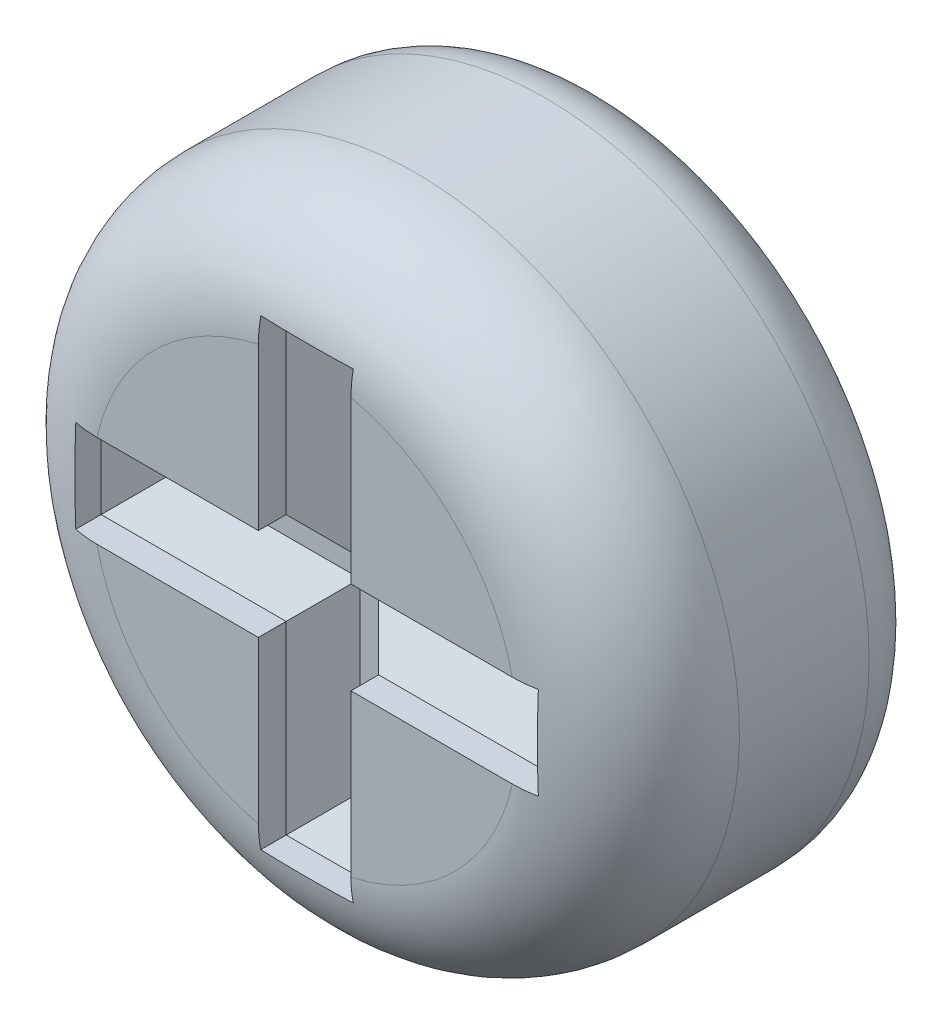
from build123d import *

# Parameters (mm, degrees)
SKETCH1_R          = 1.75
EXTRUDE1_DEPTH     = 1.651
FILLET1_R          = 0.6
CUT_EXTRUDE2_DEPTH = 0.35
CHAMFER1_SIZE      = 0.2
FILLET2_R          = 0.35


with BuildPart() as part:
    # Sketch1 → Extrude1 (new body)
    with BuildSketch(Plane.XY):
        with Locations(Location((0, 0, 0), (0, 0, 180))):
            Circle(SKETCH1_R)
    extrude(amount=EXTRUDE1_DEPTH)

    # Fillet1
    fillet1_edges = [part.edges().sort_by_distance(p)[0] for p in [
        (1.75, 0, 1.651),
    ]]
    fillet(fillet1_edges, radius=FILLET1_R)

    # Sketch2 → Cut-Extrude2 (cut)
    with BuildSketch(Plane.XY.offset(1.651)):
        Polygon((0.25, -0.25), (0.25, -1.25), (-0.25, -1.25), (-0.25, -0.25), (-1.25, -0.25), (-1.25, 0.25), (-0.25, 0.25), (-0.25, 1.25), (0.25, 1.25), (0.25, 0.25), (1.25, 0.25), (1.25, -0.25), align=None)
    extrude(amount=-CUT_EXTRUDE2_DEPTH, mode=Mode.SUBTRACT)

    # Chamfer1
    chamfer1_edges = [part.edges().sort_by_distance(p)[0] for p in [
        (-1.25, 0, 1.301),
        (-0.75, -0.25, 1.301),
        (-0.25, -0.75, 1.301),
        (0, -1.25, 1.301),
        (0.25, -0.75, 1.301),
        (0.75, -0.25, 1.301),
        (1.25, 0, 1.301),
        (0.75, 0.25, 1.301),
        (0.25, 0.75, 1.301),
        (0, 1.25, 1.301),
        (-0.25, 0.75, 1.301),
        (-0.75, 0.25, 1.301),
    ]]
    chamfer(chamfer1_edges, length=CHAMFER1_SIZE)

    # Fillet2
    fillet2_edges = [part.edges().sort_by_distance(p)[0] for p in [
        (1.75, 0, 0),
    ]]
    fillet(fillet2_edges, radius=FILLET2_R)


solid = part.part
